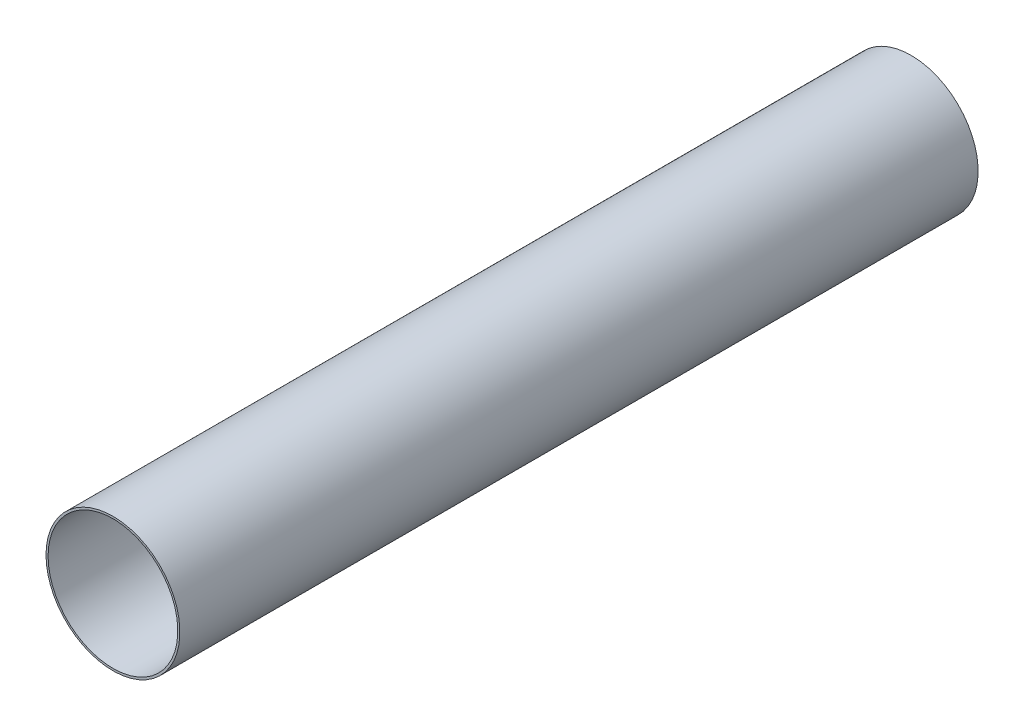
from build123d import *

# Parameters (mm, degrees)
SKETCH1_R           = 51.1175
SKETCH1_R_2         = 49.53
BOSS_EXTRUDE1_DEPTH = 609.6


with BuildPart() as part:
    # Sketch1 → Boss-Extrude1 (new body)
    with BuildSketch(Plane.XY):
        with Locations(Location((0, 0, 0), (0, 0, 180))):
            Circle(SKETCH1_R)
        with Locations(Location((0, 0, 0), (0, 0, 180))):
            Circle(SKETCH1_R_2, mode=Mode.SUBTRACT)
    extrude(amount=BOSS_EXTRUDE1_DEPTH)


solid = part.part
